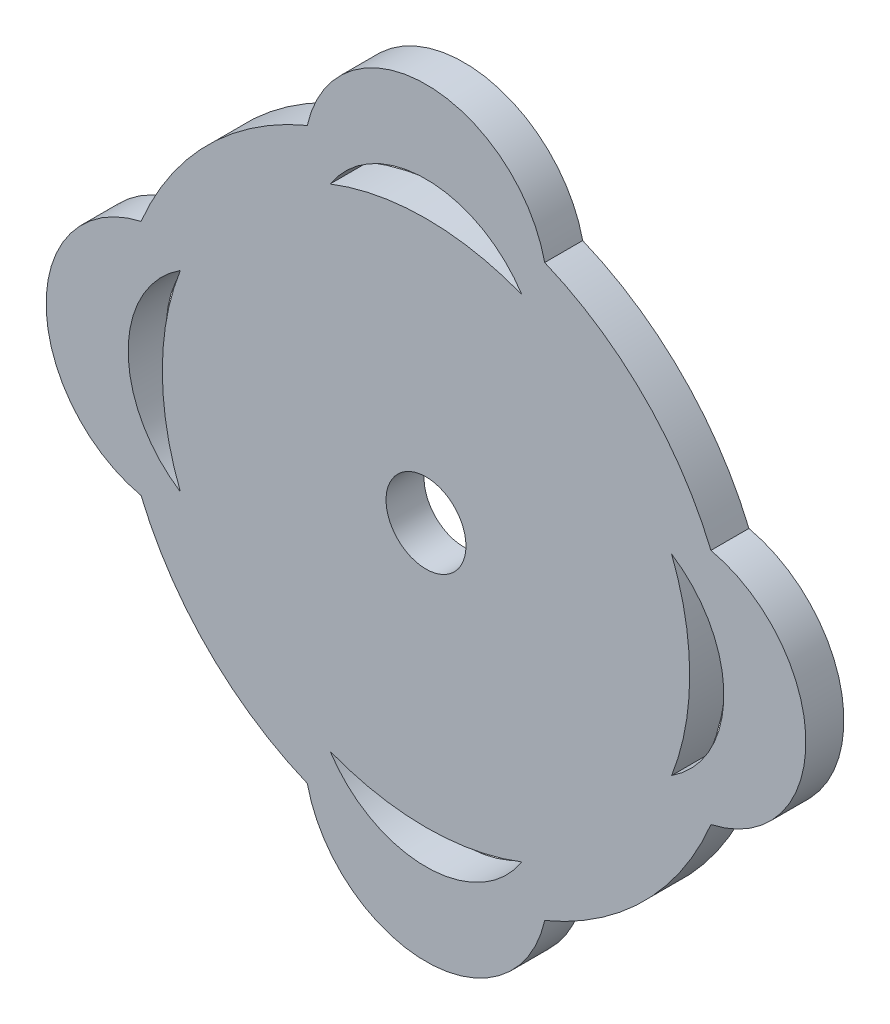
from build123d import *

# Parameters (mm, degrees)
BOSS_EXTRUDE1_DEPTH = 1.016
SCALE1_SCALE        = 1.04
SKETCH2_R           = 1.11125
NEEDLE_CUT_DEPTH    = 15.98045747
TAB_CUT_DEPTH       = 15.98045747


with BuildPart() as part:
    # Sketch1 → Boss-Extrude1 (new body)
    with BuildSketch(Plane.XY):
        with BuildLine():
            ThreePointArc((7.62, -3.175), (8.255, 0), (7.62, 3.175))
            ThreePointArc((7.62, 3.175), (10.16, 0), (7.62, -3.175))
        make_face()
        with BuildLine():
            ThreePointArc((7.62, -3.175), (8.255, 0), (7.62, 3.175))
            ThreePointArc((7.62, 3.175), (0, 8.255), (-7.62, 3.175))
            ThreePointArc((-7.62, 3.175), (-8.255, 0), (-7.62, -3.175))
            ThreePointArc((-7.62, -3.175), (0, -8.255), (7.62, -3.175))
        make_face()
        with BuildLine():
            ThreePointArc((-7.62, 3.175), (-8.255, 0), (-7.62, -3.175))
            ThreePointArc((-7.62, -3.175), (-10.16, 0), (-7.62, 3.175))
        make_face()
        with BuildLine():
            ThreePointArc((3.175, 7.62), (0, 10.16), (-3.175, 7.62))
            ThreePointArc((-3.175, 7.62), (0, 8.255), (3.175, 7.62))
        make_face()
        with BuildLine():
            ThreePointArc((3.175, -7.62), (0, -8.255), (-3.175, -7.62))
            ThreePointArc((-3.175, -7.62), (0, -10.16), (3.175, -7.62))
        make_face()
    extrude(amount=BOSS_EXTRUDE1_DEPTH)


with BuildPart() as part_1:
    # Scale1: scaled about (0, 0, 0.508)
    add(part.part.scale(SCALE1_SCALE).moved(Location((0, 0, -0.02032))))

    # Sketch2 → Needle Cut (cut, through all)
    with BuildSketch(Plane.XY.offset(1.03632)):
        Circle(SKETCH2_R)
    extrude(amount=-NEEDLE_CUT_DEPTH, mode=Mode.SUBTRACT)

    # Sketch3 → Tab Cut (cut, through all)
    with BuildSketch(Plane.XY.offset(1.03632)):
        with BuildLine():
            ThreePointArc((-2.667, 6.832154423), (0, 7.33425), (2.667, 6.832154423))
            ThreePointArc((2.667, 6.832154423), (0, 8.284442607), (-2.667, 6.832154423))
        make_face()
        with BuildLine():
            ThreePointArc((6.832154423, 2.667), (7.207633164, 1.356925658), (7.33425, 0))
            ThreePointArc((7.33425, 0), (7.207633164, -1.356925658), (6.832154423, -2.667))
            ThreePointArc((6.832154423, -2.667), (8.284442607, 0), (6.832154423, 2.667))
        make_face()
        with BuildLine():
            ThreePointArc((-2.667, -6.832154423), (0, -8.284442607), (2.667, -6.832154423))
            ThreePointArc((2.667, -6.832154423), (0, -7.33425), (-2.667, -6.832154423))
        make_face()
        with BuildLine():
            ThreePointArc((-6.832154423, -2.667), (-7.33425, 0), (-6.832154423, 2.667))
            ThreePointArc((-6.832154423, 2.667), (-8.284442607, 0), (-6.832154423, -2.667))
        make_face()
    extrude(amount=-TAB_CUT_DEPTH, mode=Mode.SUBTRACT)


solid = part_1.part
